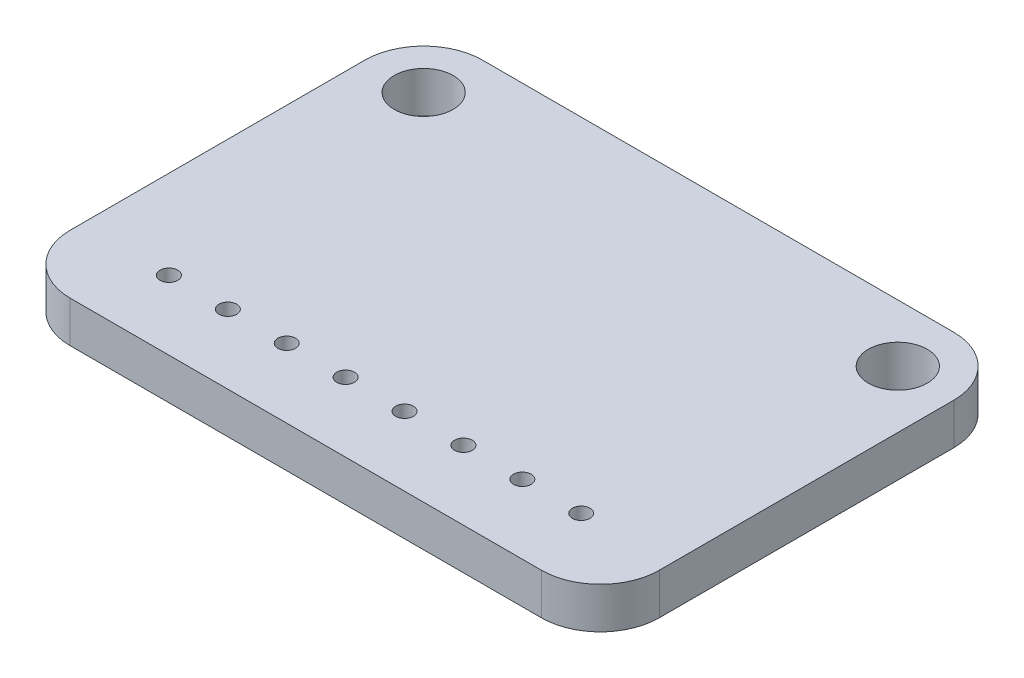
from build123d import *

# Parameters (mm, degrees)
SKETCH1_R           = 1.27
BOSS_EXTRUDE1_DEPTH = 1.778
SKETCH2_W           = 13.208
SKETCH2_H           = 2.667
BOSS_EXTRUDE2_DEPTH = 2.159
SKETCH3_R           = 0.381
CUT_EXTRUDE1_DEPTH  = 16.99443869
SKETCH4_W           = 5.111032259
SKETCH4_H           = 3.147597235
CUT_EXTRUDE2_DEPTH  = 27.997284697
CUT_EXTRUDE3_DEPTH  = 0.0254


with BuildPart() as part:
    # Sketch1 → Boss-Extrude1 (new body)
    with BuildSketch(Plane(origin=(0, 0, 0), x_dir=(1, 0, 0), z_dir=(0, 1, 0))):
        with BuildLine():
            Line((10.16, 8.89), (-10.16, 8.89))
            ThreePointArc((-10.16, 8.89), (-11.956051224, 8.146051224), (-12.7, 6.35))
            Line((-12.7, 6.35), (-12.7, -6.35))
            ThreePointArc((-12.7, -6.35), (-11.956051224, -8.146051224), (-10.16, -8.89))
            Line((-10.16, -8.89), (10.16, -8.89))
            ThreePointArc((10.16, -8.89), (11.956051224, -8.146051224), (12.7, -6.35))
            Line((12.7, -6.35), (12.7, 6.35))
            ThreePointArc((12.7, 6.35), (11.956051224, 8.146051224), (10.16, 8.89))
        make_face()
        with Locations(Location((-10.2235, 6.4135, 0), (0, 0, 270))):
            Circle(SKETCH1_R, mode=Mode.SUBTRACT)
        with Locations(Location((10.2235, 6.4135, 0), (0, 0, 270))):
            Circle(SKETCH1_R, mode=Mode.SUBTRACT)
    extrude(amount=BOSS_EXTRUDE1_DEPTH)

    # Sketch2 → Boss-Extrude2 (add)
    with BuildSketch(Plane.XZ):
        with Locations((0, 5.9055)):
            Rectangle(SKETCH2_W, SKETCH2_H)
    extrude(amount=BOSS_EXTRUDE2_DEPTH)

    # Sketch3 → Cut-Extrude1 (cut, through all)
    with BuildSketch(Plane.XZ.offset(2.159)):
        with Locations(Location((-8.89, 5.9055, 0), (0, 0, 270))):
            Circle(SKETCH3_R)
        with Locations(Location((-6.35, 5.9055, 0), (0, 0, 270))):
            Circle(SKETCH3_R)
        with Locations(Location((-3.81, 5.9055, 0), (0, 0, 270))):
            Circle(SKETCH3_R)
        with Locations(Location((6.35, 5.9055, 0), (0, 0, 270))):
            Circle(SKETCH3_R)
        with Locations(Location((8.89, 5.9055, 0), (0, 0, 270))):
            Circle(SKETCH3_R)
        with Locations(Location((-1.27, 5.9055, 0), (0, 0, 270))):
            Circle(SKETCH3_R)
        with Locations(Location((1.27, 5.9055, 0), (0, 0, 270))):
            Circle(SKETCH3_R)
        with Locations(Location((3.81, 5.9055, 0), (0, 0, 270))):
            Circle(SKETCH3_R)
    extrude(amount=-CUT_EXTRUDE1_DEPTH, mode=Mode.SUBTRACT)

    # Sketch4 → Cut-Extrude2 (cut, through all)
    with BuildSketch(Plane.ZY.offset(12.7)):
        with Locations((5.923321313, -1.573798618)):
            Rectangle(SKETCH4_W, SKETCH4_H)
    extrude(amount=-CUT_EXTRUDE2_DEPTH, mode=Mode.SUBTRACT)

    # Sketch5 → Cut-Extrude3 (cut)
    # profile 1 of 6: a face of its own
    with BuildSketch(Plane.XZ):
        with BuildLine():
            Line((-7.663685881, -4.517625083), (-7.044204711, -4.517625083))
            add(Edge.make_bspline(
                [(-7.044204711, -4.517625083), (-7.013880306, -4.517784513), (-6.955104061, -4.51809353), (-6.869633568, -4.522886084), (-6.789579289, -4.529420842), (-6.71491801, -4.539789569), (-6.64568423, -4.552300681), (-6.581669302, -4.567451614), (-6.523076789, -4.585618614), (-6.453124521, -4.61450774), (-6.373367921, -4.657436614), (-6.287009379, -4.720871813), (-6.213164105, -4.798461976), (-6.149495089, -4.885985528), (-6.098875502, -4.982265835), (-6.062254782, -5.085008099), (-6.039070138, -5.192887108), (-6.036685772, -5.266949133), (-6.035480753, -5.304378889)],
                knots=[0, 0, 0, 0, 1.001505555, 1.941167018, 2.826882275, 3.653841531, 4.429895133, 5.150066043, 5.825578002, 6.45369114, 7.647487171, 8.808567382, 9.977351308, 11.170798116, 12.373658725, 13.556498008, 14.765093433, 16, 16, 16, 16], degree=3))
            add(Edge.make_bspline(
                [(-6.035480753, -5.304378889), (-6.036472458, -5.339442278), (-6.038421252, -5.408345146), (-6.05705647, -5.509123374), (-6.08623079, -5.605054837), (-6.126784838, -5.695789429), (-6.179491649, -5.779277064), (-6.241955981, -5.856191227), (-6.317318509, -5.9232754), (-6.373782019, -5.960779318), (-6.402462924, -5.97982961)],
                knots=[0, 0, 0, 0, 1.044552857, 2.05264487, 3.044412934, 4.028983338, 5.005914585, 5.980388656, 6.974128949, 8, 8, 8, 8], degree=3))
            add(Edge.make_bspline(
                [(-6.402462924, -5.97982961), (-6.366394536, -5.993677145), (-6.297386775, -6.020170909), (-6.202421607, -6.067011651), (-6.120601998, -6.117958708), (-6.051298872, -6.173595458), (-5.992028285, -6.233565594), (-5.940273117, -6.298748447), (-5.896112156, -6.369994321), (-5.858272575, -6.446560385), (-5.828746204, -6.527664824), (-5.806633776, -6.612546885), (-5.793963305, -6.700902196), (-5.79216023, -6.761032504), (-5.791249983, -6.791388103)],
                knots=[0, 0, 0, 0, 1.27268992, 2.434971085, 3.483601985, 4.442670788, 5.356604649, 6.2567628, 7.179492994, 8.113709626, 9.066344395, 10.018646069, 10.999752585, 12, 12, 12, 12], degree=3))
            add(Edge.make_bspline(
                [(-5.791249983, -6.791388103), (-5.792136122, -6.822382337), (-5.793879625, -6.883364361), (-5.806742886, -6.972949376), (-5.828522575, -7.058560935), (-5.85852283, -7.140752779), (-5.897677215, -7.219365901), (-5.945327583, -7.294489362), (-6.002143358, -7.365368362), (-6.065700389, -7.432790506), (-6.137602478, -7.493412856), (-6.215177485, -7.547402104), (-6.299402361, -7.591803174), (-6.388893812, -7.62910128), (-6.484655728, -7.657592095), (-6.586258093, -7.677524359), (-6.693613281, -7.690954642), (-6.767282127, -7.692058821), (-6.805062083, -7.692625083)],
                knots=[0, 0, 0, 0, 0.978564426, 1.925352924, 2.850884081, 3.763762016, 4.682927383, 5.618979971, 6.567305752, 7.547517671, 8.540179244, 9.531824382, 10.526200242, 11.540722885, 12.589160233, 13.674978461, 14.80764778, 16, 16, 16, 16], degree=3))
            Line((-6.805062083, -7.692625083), (-7.663685881, -7.692625083))
            Line((-7.663685881, -7.692625083), (-7.663685881, -4.517625083))
        make_face()
        with BuildLine():
            Line((-7.378749983, -4.843266108), (-7.378749983, -5.860894313))
            Line((-7.378749983, -5.860894313), (-7.187308677, -5.860894313))
            add(Edge.make_bspline(
                [(-7.187308677, -5.860894313), (-7.159324413, -5.860531526), (-7.105253111, -5.859830547), (-7.026948634, -5.857822571), (-6.954263796, -5.85220006), (-6.887324062, -5.846579165), (-6.826234844, -5.837440075), (-6.771131484, -5.826561506), (-6.721149186, -5.8150563), (-6.663509741, -5.795489694), (-6.59812928, -5.766572088), (-6.528430679, -5.721694065), (-6.466985839, -5.668241259), (-6.415099818, -5.606563744), (-6.372635127, -5.538649418), (-6.343140543, -5.465581891), (-6.323140506, -5.3891822), (-6.321333903, -5.336732785), (-6.32041665, -5.310103047)],
                knots=[0, 0, 0, 0, 1.156816544, 2.235205308, 3.236616184, 4.169592532, 5.011045266, 5.787822928, 6.49130361, 7.128639758, 8.301311294, 9.436451833, 10.541879658, 11.654887649, 12.756523258, 13.837046038, 14.901820046, 16, 16, 16, 16], degree=3))
            add(Edge.make_bspline(
                [(-6.32041665, -5.310103047), (-6.320893971, -5.292481097), (-6.321830287, -5.257913718), (-6.32949864, -5.207522519), (-6.342532083, -5.160129972), (-6.359272763, -5.1150866), (-6.382666788, -5.07380085), (-6.410210787, -5.034845237), (-6.443489949, -4.999546387), (-6.481369796, -4.966554056), (-6.524920476, -4.937303663), (-6.574116005, -4.911685256), (-6.629621969, -4.891056123), (-6.690502916, -4.872989328), (-6.757695974, -4.860299947), (-6.830425747, -4.84972866), (-6.909287957, -4.844346815), (-6.963848157, -4.843634379), (-6.992051265, -4.843266108)],
                knots=[0, 0, 0, 0, 0.91205012, 1.789085906, 2.630437955, 3.453916878, 4.269457761, 5.079663411, 5.91843418, 6.774407191, 7.675494373, 8.627863946, 9.638891023, 10.736472738, 11.911756761, 13.175263542, 14.539845004, 16, 16, 16, 16], degree=3))
            Line((-6.992051265, -4.843266108), (-7.378749983, -4.843266108))
        make_face(mode=Mode.SUBTRACT)
        with BuildLine():
            Line((-7.378749983, -6.186535339), (-7.378749983, -7.366984057))
            Line((-7.378749983, -7.366984057), (-6.972970737, -7.366984057))
            add(Edge.make_bspline(
                [(-6.972970737, -7.366984057), (-6.943924997, -7.366635943), (-6.887943162, -7.365965), (-6.807115618, -7.363774654), (-6.732200945, -7.358792375), (-6.663540993, -7.350949355), (-6.600394368, -7.342441761), (-6.543518595, -7.331001528), (-6.492452626, -7.317894257), (-6.433239504, -7.297633972), (-6.366561322, -7.266159316), (-6.294705759, -7.218702839), (-6.230819119, -7.162166696), (-6.176567205, -7.096733652), (-6.132105422, -7.025585234), (-6.099760831, -6.950160524), (-6.079811982, -6.871705795), (-6.077397015, -6.818214563), (-6.076185881, -6.791388103)],
                knots=[0, 0, 0, 0, 1.160039823, 2.235823828, 3.228722157, 4.157150951, 4.99529583, 5.772374946, 6.472645482, 7.099169577, 8.269452708, 9.405989375, 10.527446681, 11.663510218, 12.788923519, 13.866172445, 14.929861265, 16, 16, 16, 16], degree=3))
            add(Edge.make_bspline(
                [(-6.076185881, -6.791388103), (-6.076436347, -6.774612002), (-6.076933239, -6.741330398), (-6.084426797, -6.692421048), (-6.095325093, -6.64504472), (-6.109414322, -6.59907277), (-6.12993341, -6.55533635), (-6.153887919, -6.512970456), (-6.181974333, -6.471919086), (-6.225738684, -6.420019399), (-6.289394698, -6.360223251), (-6.379842988, -6.301678517), (-6.482687858, -6.254463721), (-6.557279941, -6.234416339), (-6.595812283, -6.224060379)],
                knots=[0, 0, 0, 0, 0.723448775, 1.435228256, 2.130040452, 2.821711965, 3.505591119, 4.210454504, 4.921174351, 5.648778258, 7.137944449, 8.670945889, 10.280296675, 12, 12, 12, 12], degree=3))
            add(Edge.make_bspline(
                [(-6.595812283, -6.224060379), (-6.611260106, -6.220926124), (-6.644754172, -6.214130414), (-6.699371048, -6.206956997), (-6.761724301, -6.200566121), (-6.831957911, -6.195838857), (-6.910160738, -6.190952492), (-6.9964998, -6.18905219), (-7.090622507, -6.186785004), (-7.155929873, -6.18662069), (-7.189852748, -6.186535339)],
                knots=[0, 0, 0, 0, 0.634451884, 1.375622551, 2.216452059, 3.157844607, 4.20941857, 5.370758133, 6.634282058, 8, 8, 8, 8], degree=3))
            Line((-7.189852748, -6.186535339), (-7.378749983, -6.186535339))
        make_face(mode=Mode.SUBTRACT)
    # profile 2 of 6: a face of its own
    with BuildSketch(Plane.XZ):
        Polygon((-5.302788445, -7.692625083), (-4.883652828, -4.517625083), (-4.8429477, -4.517625083), (-3.532115368, -7.122753288), (-2.224463124, -4.517625083), (-2.183121979, -4.517625083), (-1.761442291, -7.692625083), (-2.047650224, -7.692625083), (-2.35166665, -5.408049762), (-3.497770416, -7.692625083), (-3.562008197, -7.692625083), (-4.712564086, -5.402961621), (-5.015944495, -7.692625083), align=None)
    # profile 3 of 6: a face of its own
    with BuildSketch(Plane.XZ):
        with BuildLine():
            Line((-1.11016024, -4.517625083), (-0.487498982, -4.517625083))
            add(Edge.make_bspline(
                [(-0.487498982, -4.517625083), (-0.444671945, -4.51767216), (-0.362613442, -4.517762362), (-0.244943356, -4.520497167), (-0.138073099, -4.524149952), (-0.042233111, -4.529213527), (0.042871492, -4.535197576), (0.116855614, -4.543590498), (0.180300783, -4.552353766), (0.218315919, -4.561263185), (0.235653061, -4.565326405)],
                knots=[0, 0, 0, 0, 1.415646017, 2.712440637, 3.8905458, 4.950247383, 5.884950622, 6.709939814, 7.411656543, 8, 8, 8, 8], degree=3))
            add(Edge.make_bspline(
                [(0.235653061, -4.565326405), (0.257600053, -4.571333459), (0.300976882, -4.583206019), (0.363479971, -4.606985611), (0.422946674, -4.635181576), (0.479581016, -4.66731615), (0.532687049, -4.704768054), (0.5830571, -4.746019122), (0.630246654, -4.792021759), (0.673990345, -4.842260002), (0.714162983, -4.895890478), (0.748752052, -4.953713786), (0.777714608, -5.014756611), (0.802555147, -5.078976494), (0.820433531, -5.146912716), (0.83390179, -5.218093233), (0.842450366, -5.292510417), (0.843269119, -5.343364725), (0.843685914, -5.369252687)],
                knots=[0, 0, 0, 0, 0.999701418, 1.975846123, 2.934577507, 3.890451536, 4.834027766, 5.787354733, 6.749476667, 7.726910423, 8.712836071, 9.690891519, 10.682875813, 11.679750201, 12.712814741, 13.765529915, 14.8625177, 16, 16, 16, 16], degree=3))
            add(Edge.make_bspline(
                [(0.843685914, -5.369252687), (0.843303622, -5.395358241), (0.842555641, -5.446435522), (0.833578296, -5.521159409), (0.821485908, -5.592568234), (0.802892153, -5.660503664), (0.778539293, -5.724562256), (0.749971502, -5.785722945), (0.715515014, -5.842945219), (0.675922918, -5.896436818), (0.631879686, -5.946247953), (0.583571664, -5.992017659), (0.531193877, -6.033478023), (0.474912785, -6.070721992), (0.414179708, -6.102885903), (0.349915755, -6.131694315), (0.281562344, -6.155888778), (0.234261635, -6.168616048), (0.210212356, -6.175087022)],
                knots=[0, 0, 0, 0, 1.121902311, 2.195077645, 3.232258892, 4.234102512, 5.217864754, 6.176164875, 7.132989551, 8.084763148, 9.034132444, 9.988522005, 10.94243251, 11.903244335, 12.886203696, 13.894208494, 14.929344452, 16, 16, 16, 16], degree=3))
            add(Edge.make_bspline(
                [(0.210212356, -6.175087022), (0.190321132, -6.179317012), (0.146728357, -6.188587281), (0.074934602, -6.198936381), (-0.008654427, -6.207769776), (-0.103924638, -6.21439295), (-0.210790516, -6.220062928), (-0.329309871, -6.224569698), (-0.459715355, -6.227046066), (-0.550675698, -6.227173785), (-0.598166049, -6.227240467)],
                knots=[0, 0, 0, 0, 0.601384939, 1.31797006, 2.144135048, 3.087295005, 4.142315834, 5.309527816, 6.595305764, 8, 8, 8, 8], degree=3))
            Line((-0.598166049, -6.227240467), (-0.825224342, -6.227240467))
            Line((-0.825224342, -6.227240467), (-0.825224342, -7.692625083))
            Line((-0.825224342, -7.692625083), (-1.11016024, -7.692625083))
            Line((-1.11016024, -7.692625083), (-1.11016024, -4.517625083))
        make_face()
        with BuildLine():
            Line((-0.825224342, -4.843266108), (-0.825224342, -5.901599442))
            Line((-0.825224342, -5.901599442), (-0.269344935, -5.908595635))
            add(Edge.make_bspline(
                [(-0.269344935, -5.908595635), (-0.242203288, -5.908609663), (-0.189806898, -5.908636743), (-0.114118324, -5.905021576), (-0.043897042, -5.900848236), (0.020641251, -5.894737791), (0.079525649, -5.88610065), (0.132854336, -5.877381431), (0.180213799, -5.864767281), (0.235639504, -5.847782782), (0.297400826, -5.818815338), (0.364590674, -5.776769366), (0.421532563, -5.723174724), (0.470807018, -5.662915191), (0.509910207, -5.595878124), (0.538536, -5.524151303), (0.555355479, -5.448470325), (0.557610811, -5.396683227), (0.558750017, -5.370524722)],
                knots=[0, 0, 0, 0, 1.160613943, 2.240541288, 3.23993089, 4.169200891, 5.011653406, 5.7853311, 6.478053781, 7.106038997, 8.262395093, 9.384106736, 10.481365981, 11.59014053, 12.70357646, 13.786202915, 14.881775077, 16, 16, 16, 16], degree=3))
            add(Edge.make_bspline(
                [(0.558750017, -5.370524722), (0.557604616, -5.34499907), (0.555327701, -5.294257235), (0.538404168, -5.219890787), (0.509965862, -5.148919827), (0.470544522, -5.082722814), (0.422700783, -5.022680113), (0.367093522, -4.970522005), (0.303853635, -4.928592318), (0.245027025, -4.901529269), (0.192774521, -4.885005412), (0.147388386, -4.873444021), (0.096143274, -4.864213293), (0.039022502, -4.856738887), (-0.023531197, -4.85034039), (-0.09205524, -4.845998825), (-0.166290045, -4.843457503), (-0.217825348, -4.843331451), (-0.244540248, -4.843266108)],
                knots=[0, 0, 0, 0, 1.120700087, 2.227813068, 3.331159281, 4.466773991, 5.599788987, 6.693661531, 7.80175334, 8.91857717, 9.525282508, 10.207424825, 10.974604443, 11.810962634, 12.737642355, 13.736264703, 14.826523623, 16, 16, 16, 16], degree=3))
            Line((-0.244540248, -4.843266108), (-0.825224342, -4.843266108))
        make_face(mode=Mode.SUBTRACT)
    # profile 4 of 6: a face of its own
    with BuildSketch(Plane.XZ):
        with BuildLine():
            Line((1.61708335, -5.25031739), (1.332147453, -5.25031739))
            add(Edge.make_bspline(
                [(1.332147453, -5.25031739), (1.339866831, -5.218356494), (1.354957583, -5.155875556), (1.386433239, -5.066606112), (1.420722564, -4.982129775), (1.461896966, -4.904028337), (1.506808479, -4.830732189), (1.55826409, -4.763903769), (1.613889839, -4.701843436), (1.675416757, -4.646767857), (1.739940614, -4.596895202), (1.808370591, -4.554372829), (1.87932993, -4.517793062), (1.953310272, -4.487657566), (2.030531871, -4.46495584), (2.1102966, -4.448485024), (2.19281349, -4.437788799), (2.248827375, -4.436744892), (2.277269648, -4.436214826)],
                knots=[0, 0, 0, 0, 1.162005537, 2.271625781, 3.343758855, 4.383309926, 5.390229558, 6.379919256, 7.361854164, 8.333198761, 9.295911338, 10.242430842, 11.177959212, 12.116337295, 13.062827104, 14.020064771, 14.994644689, 16, 16, 16, 16], degree=3))
            add(Edge.make_bspline(
                [(2.277269648, -4.436214826), (2.318710421, -4.437465985), (2.400688024, -4.439941011), (2.521123074, -4.462541964), (2.637261688, -4.498306192), (2.747832649, -4.547721644), (2.850537941, -4.608670135), (2.941920053, -4.681209575), (3.020740345, -4.76394037), (3.086865959, -4.855319196), (3.138641137, -4.952978123), (3.17681949, -5.053489694), (3.200062015, -5.156615482), (3.203074234, -5.2262453), (3.20458335, -5.26112969)],
                knots=[0, 0, 0, 0, 1.083050992, 2.142477498, 3.193116406, 4.255571735, 5.30263384, 6.308962982, 7.297363603, 8.282367274, 9.249857812, 10.179914175, 11.08814088, 12, 12, 12, 12], degree=3))
            add(Edge.make_bspline(
                [(3.20458335, -5.26112969), (3.203527807, -5.294700139), (3.201462272, -5.3603923), (3.183923839, -5.4562968), (3.154408801, -5.546685966), (3.113524088, -5.631940306), (3.060599967, -5.711519268), (2.996489735, -5.785601898), (2.920740892, -5.854516777), (2.863337855, -5.893995156), (2.833785073, -5.914319794)],
                knots=[0, 0, 0, 0, 1.024540389, 2.004866551, 2.965041327, 3.920577974, 4.882998113, 5.874504559, 6.905732034, 8, 8, 8, 8], degree=3))
            add(Edge.make_bspline(
                [(2.833785073, -5.914319794), (2.867559593, -5.930628564), (2.934476686, -5.962940954), (3.025690381, -6.026310106), (3.108492453, -6.099476935), (3.154669398, -6.156574913), (3.17787061, -6.185263304)],
                knots=[0, 0, 0, 0, 1.015518401, 2.012035669, 3.001164323, 4, 4, 4, 4], degree=3))
            add(Edge.make_bspline(
                [(3.17787061, -6.185263304), (3.193148113, -6.206179978), (3.22345294, -6.247670803), (3.26085946, -6.314378846), (3.294794871, -6.381826269), (3.321238284, -6.451820873), (3.341716006, -6.523551392), (3.356353693, -6.597140994), (3.36544702, -6.672649772), (3.366749271, -6.723733236), (3.367403863, -6.74941094)],
                knots=[0, 0, 0, 0, 1.025084078, 2.033381695, 3.024893161, 4.013698104, 4.991890475, 5.976764909, 6.982997093, 8, 8, 8, 8], degree=3))
            add(Edge.make_bspline(
                [(3.367403863, -6.74941094), (3.365775983, -6.793869758), (3.362527883, -6.882578172), (3.333495616, -7.013637383), (3.288489319, -7.141749089), (3.224574813, -7.264281265), (3.146680715, -7.378926324), (3.054009428, -7.48150269), (2.947613901, -7.56967571), (2.828954491, -7.643344988), (2.70039681, -7.702234818), (2.562896094, -7.743108355), (2.418433545, -7.769729369), (2.319366926, -7.772584029), (2.269001419, -7.774035339)],
                knots=[0, 0, 0, 0, 0.955779014, 1.907060117, 2.875433937, 3.871313158, 4.872415639, 5.851225146, 6.836215519, 7.83643374, 8.849228613, 9.86973379, 10.916971861, 12, 12, 12, 12], degree=3))
            add(Edge.make_bspline(
                [(2.269001419, -7.774035339), (2.235056768, -7.773247745), (2.168265014, -7.771698024), (2.070072698, -7.761103865), (1.976345156, -7.741754503), (1.886955664, -7.715716504), (1.801824809, -7.682703995), (1.721212371, -7.641593462), (1.644622396, -7.593232314), (1.572777633, -7.537049702), (1.505686647, -7.47420163), (1.44513239, -7.403572385), (1.390105292, -7.326467597), (1.342078756, -7.241991682), (1.298865234, -7.151236341), (1.263322509, -7.053039489), (1.232039172, -6.948278983), (1.217494529, -6.875274176), (1.210032068, -6.83781739)],
                knots=[0, 0, 0, 0, 1.048658725, 2.063410685, 3.046034179, 4.001477787, 4.936774919, 5.862367409, 6.792675028, 7.730719943, 8.675894397, 9.627829632, 10.600096036, 11.597688215, 12.626045268, 13.701542398, 14.82072376, 16, 16, 16, 16], degree=3))
            Line((1.210032068, -6.83781739), (1.494967965, -6.83781739))
            add(Edge.make_bspline(
                [(1.494967965, -6.83781739), (1.50239138, -6.862263995), (1.516830565, -6.909814765), (1.541408964, -6.9782499), (1.569410897, -7.040986134), (1.599450532, -7.09848368), (1.630999551, -7.151308788), (1.666300948, -7.198064626), (1.702740101, -7.240804845), (1.7302078, -7.2648846), (1.743650858, -7.276669554)],
                knots=[0, 0, 0, 0, 1.198163088, 2.33053128, 3.407730985, 4.417276592, 5.372219308, 6.28897303, 7.162600585, 8, 8, 8, 8], degree=3))
            add(Edge.make_bspline(
                [(1.743650858, -7.276669554), (1.761427752, -7.290374971), (1.796926668, -7.3177435), (1.854773563, -7.352669977), (1.915610996, -7.382933193), (1.980757164, -7.406050545), (2.048806278, -7.425624566), (2.120858245, -7.438433894), (2.196277392, -7.44722245), (2.247773863, -7.447997995), (2.27408956, -7.448394313)],
                knots=[0, 0, 0, 0, 0.946170439, 1.889420265, 2.845303464, 3.807233317, 4.801018734, 5.828864929, 6.890507805, 8, 8, 8, 8], degree=3))
            add(Edge.make_bspline(
                [(2.27408956, -7.448394313), (2.303801666, -7.447835599), (2.361901124, -7.446743082), (2.446678032, -7.436695834), (2.527329788, -7.422063244), (2.602960942, -7.39946361), (2.674562188, -7.371540981), (2.741129828, -7.336481356), (2.803537724, -7.295347215), (2.860986542, -7.248593836), (2.912644252, -7.197411479), (2.958127953, -7.143878193), (2.996794611, -7.088219691), (3.027985428, -7.030127967), (3.052614856, -6.969843581), (3.069381759, -6.907197357), (3.081039919, -6.84270198), (3.081989346, -6.798860701), (3.082467965, -6.776759698)],
                knots=[0, 0, 0, 0, 1.217147791, 2.380027433, 3.494444702, 4.572153297, 5.609568379, 6.639424714, 7.649109417, 8.668170816, 9.669597737, 10.625200337, 11.543417969, 12.441394052, 13.322311151, 14.205496177, 15.095365482, 16, 16, 16, 16], degree=3))
            add(Edge.make_bspline(
                [(3.082467965, -6.776759698), (3.081079763, -6.747176555), (3.078310267, -6.68815747), (3.057166055, -6.601327956), (3.022387228, -6.517668147), (2.973698593, -6.438605394), (2.914429754, -6.365330112), (2.845155874, -6.299950981), (2.765301695, -6.246003113), (2.6918051, -6.208729832), (2.626703851, -6.183296199), (2.570991323, -6.166355339), (2.508619262, -6.152010094), (2.440341931, -6.138663962), (2.36564487, -6.127305311), (2.284609401, -6.117833092), (2.197219103, -6.110253876), (2.136720689, -6.10686924), (2.105544888, -6.105125083)],
                knots=[0, 0, 0, 0, 1.07054697, 2.135767047, 3.216561865, 4.33974944, 5.486079747, 6.621378074, 7.775625952, 8.963672916, 9.598146892, 10.304877434, 11.070270905, 11.915000392, 12.823868403, 13.805723172, 14.86925407, 16, 16, 16, 16], degree=3))
            Line((2.105544888, -6.105125083), (2.105544888, -5.779484057))
            add(Edge.make_bspline(
                [(2.105544888, -5.779484057), (2.144825232, -5.778817485), (2.221765775, -5.777511834), (2.334155608, -5.761720282), (2.441627827, -5.739875712), (2.541800657, -5.706415574), (2.633103419, -5.667553304), (2.712314772, -5.622330228), (2.77832497, -5.572061135), (2.830813228, -5.515970125), (2.870300456, -5.455812903), (2.899171908, -5.393114221), (2.91622649, -5.327324537), (2.918503116, -5.282425802), (2.919647453, -5.259857655)],
                knots=[0, 0, 0, 0, 1.321986639, 2.589447074, 3.816329219, 5.01088745, 6.139805852, 7.153945165, 8.075214402, 8.924034688, 9.728124013, 10.488707548, 11.240355623, 12, 12, 12, 12], degree=3))
            add(Edge.make_bspline(
                [(2.919647453, -5.259857655), (2.919271523, -5.243277129), (2.918523628, -5.210290959), (2.909091812, -5.162098932), (2.894918574, -5.115380217), (2.875433391, -5.070333489), (2.849352854, -5.027271169), (2.818141709, -4.985826126), (2.780977789, -4.946234984), (2.738391563, -4.909332122), (2.692660854, -4.874162886), (2.642541415, -4.844305515), (2.589544429, -4.818773923), (2.53361122, -4.797719589), (2.474560275, -4.781881521), (2.41266904, -4.770509722), (2.347819499, -4.763399849), (2.303576571, -4.762376215), (2.281085754, -4.761855852)],
                knots=[0, 0, 0, 0, 0.884392785, 1.759457502, 2.611959086, 3.489218968, 4.37281399, 5.2945488, 6.255912374, 7.266815255, 8.301784654, 9.332968512, 10.37626691, 11.440494194, 12.520033166, 13.637162961, 14.798855837, 16, 16, 16, 16], degree=3))
            add(Edge.make_bspline(
                [(2.281085754, -4.761855852), (2.244934598, -4.763118016), (2.174322982, -4.765583316), (2.072528022, -4.78717605), (1.977895483, -4.821627597), (1.905561121, -4.862751121), (1.852146215, -4.903346158), (1.813976421, -4.938799466), (1.776492815, -4.978199241), (1.742161379, -5.023972196), (1.707441415, -5.073018499), (1.67583242, -5.12783141), (1.645116842, -5.18698111), (1.626608815, -5.228796436), (1.61708335, -5.25031739)],
                knots=[0, 0, 0, 0, 1.472543308, 2.876219568, 4.221790263, 5.565193594, 6.249813518, 6.953379497, 7.687249741, 8.463570142, 9.283606569, 10.136032583, 11.040678096, 12, 12, 12, 12], degree=3))
        make_face()
    # profile 5 of 6: a face of its own
    with BuildSketch(Plane.XZ):
        with BuildLine():
            Line((4.34432694, -7.774035339), (4.116632629, -7.61566695))
            Line((4.116632629, -7.61566695), (4.999425097, -6.325187182))
            add(Edge.make_bspline(
                [(4.999425097, -6.325187182), (4.943099929, -6.332075175), (4.832192535, -6.345638018), (4.720489592, -6.348129626), (4.665515842, -6.349355852)],
                knots=[0, 0, 0, 0, 1.015715272, 2, 2, 2, 2], degree=3))
            add(Edge.make_bspline(
                [(4.665515842, -6.349355852), (4.632185556, -6.348502161), (4.566761119, -6.346826441), (4.470575262, -6.333544229), (4.378150504, -6.313088041), (4.289731874, -6.282563814), (4.204987037, -6.244628724), (4.124100997, -6.197587005), (4.047182639, -6.142245583), (3.97505806, -6.078897083), (3.909460983, -6.009339136), (3.851019849, -5.935719374), (3.802450393, -5.857182601), (3.762103776, -5.775330901), (3.731505436, -5.688987819), (3.709223706, -5.599135863), (3.69550557, -5.505145302), (3.693873533, -5.441168934), (3.693044888, -5.40868578)],
                knots=[0, 0, 0, 0, 1.060718605, 2.082097864, 3.085795603, 4.069760067, 5.054557537, 6.03741023, 7.043284206, 8.066802108, 9.088538119, 10.083643548, 11.053783639, 12.022749082, 12.983451788, 13.964007469, 14.966251758, 16, 16, 16, 16], degree=3))
            add(Edge.make_bspline(
                [(3.693044888, -5.40868578), (3.694618269, -5.364264216), (3.697706495, -5.277073698), (3.722560864, -5.149680208), (3.763437029, -5.029223843), (3.820431342, -4.91602131), (3.892217839, -4.811701025), (3.978494917, -4.717713216), (4.078737799, -4.63539467), (4.190662917, -4.564633828), (4.311633157, -4.507724223), (4.438332582, -4.465778572), (4.569790391, -4.441105422), (4.658842492, -4.437852534), (4.7036769, -4.436214826)],
                knots=[0, 0, 0, 0, 1.022988612, 2.007919123, 2.978103895, 3.94594894, 4.918897164, 5.887013414, 6.875921846, 7.89917871, 8.930658928, 9.948724884, 10.967259574, 12, 12, 12, 12], degree=3))
            add(Edge.make_bspline(
                [(4.7036769, -4.436214826), (4.747662823, -4.437875045), (4.834574862, -4.441155482), (4.962381318, -4.465180226), (5.084792098, -4.505672065), (5.201128621, -4.561628776), (5.308842231, -4.631769885), (5.405703145, -4.71534906), (5.489500956, -4.81241836), (5.560098333, -4.920630062), (5.616767584, -5.036895823), (5.657654584, -5.158256953), (5.682823842, -5.28384065), (5.68599551, -5.368925637), (5.68759617, -5.411865868)],
                knots=[0, 0, 0, 0, 1.026385292, 2.028040595, 3.023318987, 4.028184125, 5.03290303, 6.015178782, 7.004435299, 8.016004309, 9.023023918, 10.015172535, 10.998308025, 12, 12, 12, 12], degree=3))
            add(Edge.make_bspline(
                [(5.68759617, -5.411865868), (5.686527185, -5.445197714), (5.684359016, -5.512803026), (5.669176795, -5.615519122), (5.643395627, -5.72024988), (5.614138728, -5.808897328), (5.585897405, -5.882111422), (5.559317093, -5.939943212), (5.529823925, -6.000813644), (5.495426188, -6.064084443), (5.458448961, -6.130562171), (5.416666617, -6.199580064), (5.371032277, -6.271230736), (5.338529603, -6.319533452), (5.321886034, -6.344267711)],
                knots=[0, 0, 0, 0, 1.179839688, 2.393009684, 3.667231171, 4.993948276, 5.694988576, 6.444077775, 7.246288328, 8.089075292, 8.993003841, 9.939041771, 10.944649915, 12, 12, 12, 12], degree=3))
            Line((5.321886034, -6.344267711), (4.34432694, -7.774035339))
        make_face()
        with BuildLine():
            add(Edge.make_bspline(
                [(4.718305305, -6.023714826), (4.743554732, -6.023025049), (4.792706783, -6.021682289), (4.864713333, -6.013509619), (4.932680289, -5.999018932), (4.996789208, -5.978227479), (5.057682897, -5.953138929), (5.114394138, -5.921196627), (5.166970392, -5.883081537), (5.215763726, -5.840255309), (5.259092497, -5.792675136), (5.297685103, -5.742875618), (5.330487904, -5.690638151), (5.356398877, -5.635308548), (5.377702741, -5.578233652), (5.392414795, -5.518494344), (5.400564869, -5.456401867), (5.401954226, -5.414220941), (5.402660273, -5.392785339)],
                knots=[0, 0, 0, 0, 1.163407946, 2.26475976, 3.333800367, 4.359385343, 5.366239384, 6.363380779, 7.350133999, 8.353570782, 9.349036268, 10.310270964, 11.253520213, 12.184142, 13.120487599, 14.056272588, 15.012232024, 16, 16, 16, 16], degree=3))
            add(Edge.make_bspline(
                [(5.402660273, -5.392785339), (5.402052787, -5.371340786), (5.400855663, -5.329081663), (5.391251469, -5.266897256), (5.374355731, -5.207304083), (5.351685791, -5.149975893), (5.321822433, -5.095383699), (5.285987128, -5.042842101), (5.243412691, -4.992684242), (5.194424649, -4.946089771), (5.14159759, -4.903138463), (5.085299851, -4.865232522), (5.025995463, -4.833463294), (4.964046233, -4.8072478), (4.899323088, -4.786790118), (4.831864327, -4.772078651), (4.761329066, -4.763939988), (4.713448899, -4.762559413), (4.689048494, -4.761855852)],
                knots=[0, 0, 0, 0, 0.972161553, 1.915763587, 2.844109794, 3.775983486, 4.705125789, 5.659731448, 6.655561913, 7.682237399, 8.721216875, 9.739758359, 10.754845918, 11.767244016, 12.7857855, 13.828538656, 14.893392813, 16, 16, 16, 16], degree=3))
            add(Edge.make_bspline(
                [(4.689048494, -4.761855852), (4.664860298, -4.762560549), (4.617403256, -4.763943159), (4.547495054, -4.772063181), (4.480492423, -4.786889056), (4.415956811, -4.807238324), (4.354009421, -4.83346525), (4.29470783, -4.865234187), (4.238396922, -4.903129737), (4.185620511, -4.946123566), (4.136545968, -4.99246736), (4.094703524, -5.043061827), (4.058786207, -5.095356367), (4.028963883, -5.149983157), (4.006283028, -5.207302145), (3.989390213, -5.266897781), (3.979785234, -5.329081526), (3.978588217, -5.371340739), (3.977980786, -5.392785339)],
                knots=[0, 0, 0, 0, 1.099389452, 2.15699305, 3.192601482, 4.213358962, 5.227959689, 6.245255729, 7.266013209, 8.307253147, 9.336162325, 10.327954924, 11.284637477, 12.215801273, 13.149702402, 14.080068371, 15.025723358, 16, 16, 16, 16], degree=3))
            add(Edge.make_bspline(
                [(3.977980786, -5.392785339), (3.978530447, -5.414237634), (3.979614481, -5.456545485), (3.990071833, -5.518708713), (4.007559987, -5.578297289), (4.030981862, -5.635890616), (4.061826162, -5.690928658), (4.099675653, -5.74315048), (4.144039969, -5.793148066), (4.194326062, -5.840144609), (4.249360751, -5.883281225), (4.308140656, -5.920955214), (4.369653865, -5.952770932), (4.434116916, -5.978299187), (4.501052084, -5.998811196), (4.571060954, -6.013482912), (4.643911998, -6.021603897), (4.693269624, -6.023004432), (4.718305305, -6.023714826)],
                knots=[0, 0, 0, 0, 0.952633368, 1.87876736, 2.791047057, 3.707742249, 4.635551637, 5.587206343, 6.568248508, 7.601284464, 8.641511608, 9.671105535, 10.699146789, 11.713763218, 12.747829548, 13.806491675, 14.887386225, 16, 16, 16, 16], degree=3))
        make_face(mode=Mode.SUBTRACT)
    # profile 6 of 6: a face of its own
    with BuildSketch(Plane.XZ):
        with BuildLine():
            add(Edge.make_bspline(
                [(6.094647453, -6.106397118), (6.094945012, -6.055508773), (6.095523025, -5.95665743), (6.101953236, -5.812617076), (6.112635153, -5.677488814), (6.127274056, -5.551266176), (6.145088509, -5.433916575), (6.168869701, -5.325753617), (6.195914172, -5.226276688), (6.227258176, -5.135161401), (6.26262567, -5.051180199), (6.301119607, -4.972780195), (6.34426767, -4.900080014), (6.38960387, -4.831919304), (6.438963392, -4.769413809), (6.490941581, -4.711680823), (6.54756714, -4.660054642), (6.606915154, -4.613022639), (6.669522947, -4.571793475), (6.733605937, -4.535478062), (6.799605212, -4.504453897), (6.867700963, -4.48006043), (6.937281141, -4.459912019), (7.00858898, -4.446133474), (7.081742217, -4.437463993), (7.131119304, -4.436635165), (7.156160874, -4.436214826)],
                knots=[0, 0, 0, 0, 1.646270934, 3.197905019, 4.663502075, 6.030701355, 7.308322542, 8.50163776, 9.611534131, 10.641858119, 11.616356847, 12.558055219, 13.465016945, 14.349605745, 15.204443733, 16.039544428, 16.859896111, 17.680448484, 18.487036065, 19.28249412, 20.06191084, 20.843045899, 21.620316918, 22.403196591, 23.190181807, 24, 24, 24, 24], degree=3))
            add(Edge.make_bspline(
                [(7.156160874, -4.436214826), (7.181411629, -4.436657344), (7.231627438, -4.437537373), (7.305868349, -4.445995521), (7.378394132, -4.46003004), (7.448895586, -4.479915496), (7.517951824, -4.504585859), (7.585022708, -4.535507744), (7.650524847, -4.571502145), (7.713417322, -4.613796663), (7.77439058, -4.660952013), (7.831946946, -4.714258148), (7.88609166, -4.773176822), (7.937504258, -4.837077656), (7.984726122, -4.907186269), (8.029696307, -4.982283283), (8.069948082, -5.063681996), (8.108714537, -5.150024277), (8.142176304, -5.243699168), (8.172353541, -5.344178629), (8.196736605, -5.452649498), (8.217046873, -5.568542664), (8.232781172, -5.692283738), (8.244240783, -5.823607467), (8.250294224, -5.96260025), (8.251434232, -6.057630585), (8.252019247, -6.106397118)],
                knots=[0, 0, 0, 0, 0.810914788, 1.612654377, 2.396697861, 3.181598691, 3.963628158, 4.749916497, 5.551656086, 6.361998678, 7.18212741, 8.025565596, 8.878627764, 9.750805457, 10.657531673, 11.591944965, 12.560506719, 13.57287815, 14.630710178, 15.753379473, 16.941251878, 18.199788006, 19.531962791, 20.947069417, 22.433333509, 24, 24, 24, 24], degree=3))
            add(Edge.make_bspline(
                [(8.252019247, -6.106397118), (8.251428167, -6.154950949), (8.250276471, -6.249556108), (8.244308644, -6.387923493), (8.232553315, -6.518550289), (8.21784854, -6.64174978), (8.197482309, -6.757009191), (8.17244048, -6.86472737), (8.144636258, -6.965369492), (8.110314695, -7.058111071), (8.072749265, -7.144245848), (8.031877765, -7.224679618), (7.988090137, -7.300123327), (7.940384633, -7.369973097), (7.88953618, -7.434723736), (7.834456471, -7.493232294), (7.776698155, -7.546908546), (7.715545463, -7.594671094), (7.651672128, -7.636476595), (7.586394965, -7.673863445), (7.518555753, -7.704010247), (7.44969186, -7.729895606), (7.378818271, -7.74967173), (7.306023331, -7.76334587), (7.231677317, -7.772936047), (7.181420183, -7.77366764), (7.156160874, -7.774035339)],
                knots=[0, 0, 0, 0, 1.561518951, 3.042555995, 4.452378317, 5.7783523, 7.031515105, 8.214008947, 9.334062868, 10.386615937, 11.391082383, 12.354592575, 13.286541444, 14.194233754, 15.072674879, 15.931287219, 16.775624067, 17.606195743, 18.42308326, 19.229000347, 20.022332153, 20.807536673, 21.593273796, 22.3848459, 23.188221202, 24, 24, 24, 24], degree=3))
            add(Edge.make_bspline(
                [(7.156160874, -7.774035339), (7.131119999, -7.773612288), (7.081744282, -7.772778114), (7.00858101, -7.7641478), (6.937567651, -7.750272594), (6.868353781, -7.730844674), (6.800584299, -7.707064073), (6.735182668, -7.676081803), (6.671421698, -7.640400183), (6.6094715, -7.599764336), (6.550496183, -7.553208238), (6.494163877, -7.501714919), (6.441889752, -7.443999396), (6.393235965, -7.380972994), (6.346995185, -7.313215553), (6.304459825, -7.239801958), (6.265116265, -7.161023304), (6.229153956, -7.076370628), (6.197269096, -6.984608657), (6.16910439, -6.884687617), (6.146866547, -6.775725576), (6.127832009, -6.658597678), (6.112479176, -6.532800613), (6.101997752, -6.398266086), (6.095519559, -6.255077932), (6.09494346, -6.156861779), (6.094647453, -6.106397118)],
                knots=[0, 0, 0, 0, 0.810891512, 1.598919785, 2.382837074, 3.152667961, 3.926044502, 4.706494248, 5.493654104, 6.291793342, 7.103789334, 7.925228297, 8.761435821, 9.622817696, 10.50288917, 11.416980706, 12.369136599, 13.353924996, 14.394355917, 15.514179734, 16.714354668, 17.994756427, 19.357759367, 20.818452758, 22.365282078, 24, 24, 24, 24], degree=3))
        make_face()
        with BuildLine():
            add(Edge.make_bspline(
                [(6.37958335, -6.105125083), (6.379691706, -6.147532831), (6.379902002, -6.229837943), (6.385395841, -6.349438615), (6.39287998, -6.460990271), (6.402533157, -6.56463455), (6.416868689, -6.660020633), (6.432931275, -6.74780456), (6.452478471, -6.827521768), (6.475606094, -6.899719282), (6.501948703, -6.965622365), (6.530710451, -7.026946325), (6.561608393, -7.084415581), (6.596187908, -7.137513926), (6.633848001, -7.186414518), (6.673738029, -7.231982873), (6.71734673, -7.272620134), (6.777675125, -7.321358067), (6.85731907, -7.371721853), (6.957667626, -7.415578663), (7.060781149, -7.443139891), (7.130768355, -7.44664487), (7.165701138, -7.448394313)],
                knots=[0, 0, 0, 0, 1.459021318, 2.831673884, 4.118529203, 5.306027144, 6.411944654, 7.436330062, 8.375795394, 9.233974572, 10.042671642, 10.816086306, 11.563610507, 12.285937304, 12.993564865, 13.685989202, 14.367179055, 15.041617293, 16.353048772, 17.594441528, 18.799311195, 20, 20, 20, 20], degree=3))
            add(Edge.make_bspline(
                [(7.165701138, -7.448394313), (7.200859883, -7.446944898), (7.271104784, -7.444049059), (7.373733298, -7.416110205), (7.473365043, -7.373955694), (7.551444589, -7.324110457), (7.61084661, -7.276641187), (7.653407023, -7.236169327), (7.692470452, -7.190852219), (7.729520049, -7.141957858), (7.763500782, -7.088552104), (7.794400914, -7.030891768), (7.822597951, -6.968816728), (7.838662585, -6.92548275), (7.846876018, -6.903327206)],
                knots=[0, 0, 0, 0, 1.353760809, 2.704726607, 4.075137775, 5.516104923, 6.260822281, 7.007110065, 7.778089737, 8.566572457, 9.372053459, 10.217411131, 11.088608312, 12, 12, 12, 12], degree=3))
            add(Edge.make_bspline(
                [(7.846876018, -6.903327206), (7.856447979, -6.874997371), (7.875883164, -6.817475656), (7.900930988, -6.728245772), (7.920657172, -6.634626122), (7.938403939, -6.537176194), (7.950517069, -6.435177323), (7.960266871, -6.328945103), (7.966009708, -6.218399439), (7.966721589, -6.143292554), (7.96708335, -6.105125083)],
                knots=[0, 0, 0, 0, 0.884706709, 1.796334032, 2.740027952, 3.714592787, 4.726048262, 5.777819803, 6.87074269, 8, 8, 8, 8], degree=3))
            add(Edge.make_bspline(
                [(7.96708335, -6.105125083), (7.96658425, -6.066963785), (7.965607903, -5.992312128), (7.961875928, -5.882984921), (7.952238829, -5.77914631), (7.941535342, -5.680348952), (7.925753577, -5.587139749), (7.908737567, -5.498738401), (7.885876467, -5.416240085), (7.861456386, -5.338353179), (7.833506955, -5.265962585), (7.802740539, -5.198730793), (7.76988223, -5.136333222), (7.734193197, -5.078941068), (7.696097113, -5.026297261), (7.654588479, -4.979457307), (7.611313798, -4.936969486), (7.550701065, -4.888471298), (7.471349388, -4.839021403), (7.372610837, -4.793513892), (7.269858181, -4.767380656), (7.200395119, -4.763696125), (7.165701138, -4.761855852)],
                knots=[0, 0, 0, 0, 1.31362396, 2.569729283, 3.763502607, 4.902122613, 5.988968491, 7.01645872, 7.998833611, 8.933434873, 9.825090667, 10.667526885, 11.477055099, 12.250526234, 12.991942729, 13.710640831, 14.402115721, 15.076753259, 16.378508321, 17.609869233, 18.806226677, 20, 20, 20, 20], degree=3))
            add(Edge.make_bspline(
                [(7.165701138, -4.761855852), (7.130585101, -4.763698664), (7.060289054, -4.767387646), (6.956468409, -4.793416526), (6.85695089, -4.838785431), (6.777809049, -4.888635083), (6.717154043, -4.936113408), (6.674443314, -4.977285406), (6.634396429, -5.022321651), (6.597505015, -5.071671959), (6.562952594, -5.1247084), (6.531219818, -5.181848208), (6.502629098, -5.243380945), (6.476245269, -5.309254426), (6.453047097, -5.381445711), (6.433911859, -5.461064727), (6.416234318, -5.548569443), (6.403720038, -5.64447214), (6.392595059, -5.748142379), (6.385445551, -5.859972517), (6.379883625, -5.979773777), (6.379685446, -6.062504442), (6.37958335, -6.105125083)],
                knots=[0, 0, 0, 0, 1.207732386, 2.417664972, 3.655092373, 4.956220595, 5.625982001, 6.301752483, 6.994047911, 7.697131622, 8.419323945, 9.170223765, 9.943494443, 10.752040957, 11.610060368, 12.549350801, 13.567764191, 14.679664412, 15.874934091, 17.154273443, 18.533957287, 20, 20, 20, 20], degree=3))
        make_face(mode=Mode.SUBTRACT)
    extrude(amount=-CUT_EXTRUDE3_DEPTH, mode=Mode.SUBTRACT)


solid = part.part
